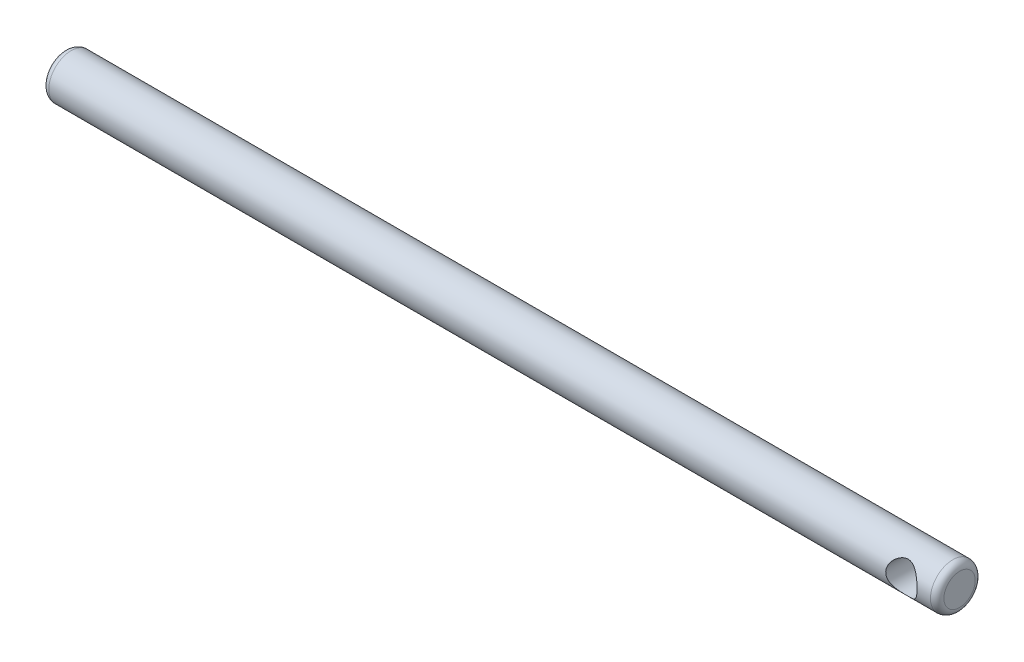
from build123d import *

# Parameters (mm, degrees)
SKIZZE1_W                        = 100
SKIZZE1_H                        = 2.5
VERRUNDUNG1_R                    = 0.75
VERRUNDUNG2_R                    = 0.75
F_3_5_3_5_DURCHMESSER_BOHRUNG1_D = 3.5


with BuildPart() as part:
    # Skizze1 → Rotation1 (revolve)
    with BuildSketch(Plane.XY):
        with Locations((-50, 1.25)):
            Rectangle(SKIZZE1_W, SKIZZE1_H)
    revolve(axis=Axis((0, 0, 0), (-1, 0, 0)))

    # Verrundung1
    verrundung1_edges = [part.edges().sort_by_distance(p)[0] for p in [
        (-100, -2.5, 0),
    ]]
    fillet(verrundung1_edges, radius=VERRUNDUNG1_R)

    # Verrundung2
    verrundung2_edges = [part.edges().sort_by_distance(p)[0] for p in [
        (0, -2.5, 0),
    ]]
    fillet(verrundung2_edges, radius=VERRUNDUNG2_R)

    # Ø3.5 (3.5) Durchmesser Bohrung1 (through all)
    with Locations(Plane(origin=(-4, 0.063040866, 2.499205043), x_dir=(0, 0.999682017384, -0.025216346285), z_dir=(0, 0.025216346285, 0.999682017384))):
        with Locations((0, 0)):
            Hole(F_3_5_3_5_DURCHMESSER_BOHRUNG1_D / 2)


solid = part.part
